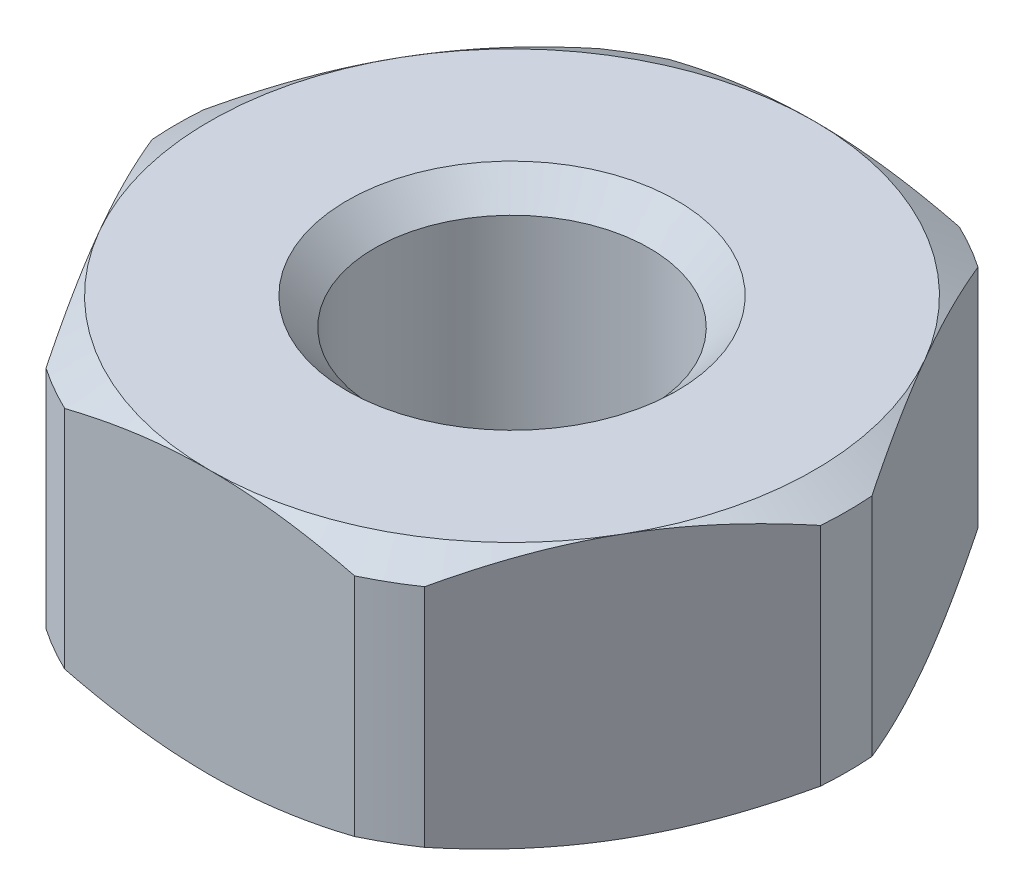
from build123d import *

# Parameters (mm, degrees)
SKETCH1_R           = 3.05
BOSS_EXTRUDE1_DEPTH = 2.4
SKETCH2_OUTSIDE_W   = 9.89
SKETCH2_OUTSIDE_H   = 9.89
CUT_EXTRUDE1_DEPTH  = 2.4
M3_TAPPED_HOLE1_D   = 2.5
CHAMFER1_SIZE       = 0.25


with BuildPart() as part:
    # Sketch1 → Boss-Extrude1 (new body)
    with BuildSketch(Plane(origin=(0, 0, 0), x_dir=(1, 0, 0), z_dir=(0, 1, 0))):
        with Locations(Location((0, 0, 0), (0, 0, 270))):
            Circle(SKETCH1_R)
    extrude(amount=BOSS_EXTRUDE1_DEPTH)

    # Sketch2 outside → Cut-Extrude1 (cut)
    with BuildSketch(Plane(origin=(0, 2.4, 0), x_dir=(1, 0, 0), z_dir=(0, 1, 0))):
        Rectangle(SKETCH2_OUTSIDE_W, SKETCH2_OUTSIDE_H)
        Polygon((1.58771324, 2.75), (-1.58771324, 2.75), (-3.175426481, 0), (-1.58771324, -2.75), (1.58771324, -2.75), (3.175426481, 0), align=None, mode=Mode.SUBTRACT)
    extrude(amount=-CUT_EXTRUDE1_DEPTH, mode=Mode.SUBTRACT)

    # Sketch3 → Cut-Revolve1 (revolve, cut)
    with BuildSketch(Plane(origin=(0, 0, 0), x_dir=(0, 0, -1), z_dir=(1, 0, 0))):
        Polygon((2.75, 2.4), (4, 2.4), (4, 1.678312164), align=None)
        Polygon((4, 0), (2.75, 0), (4, 0.721687836), align=None)
    revolve(axis=Axis((0, 0, 0), (0, 1, 0)), mode=Mode.SUBTRACT)

    # M3 Tapped Hole1 (through all)
    with Locations(Plane(origin=(0, 2.4, 0), x_dir=(1, 0, 0), z_dir=(0, 1, 0))):
        with Locations((0, 0)):
            Hole(M3_TAPPED_HOLE1_D / 2)

    # Chamfer1
    chamfer1_edges = [part.edges().sort_by_distance(p)[0] for p in [
        (1.25, 2.4, 0),
        (1.25, 0, 0),
    ]]
    chamfer(chamfer1_edges, length=CHAMFER1_SIZE)


solid = part.part
